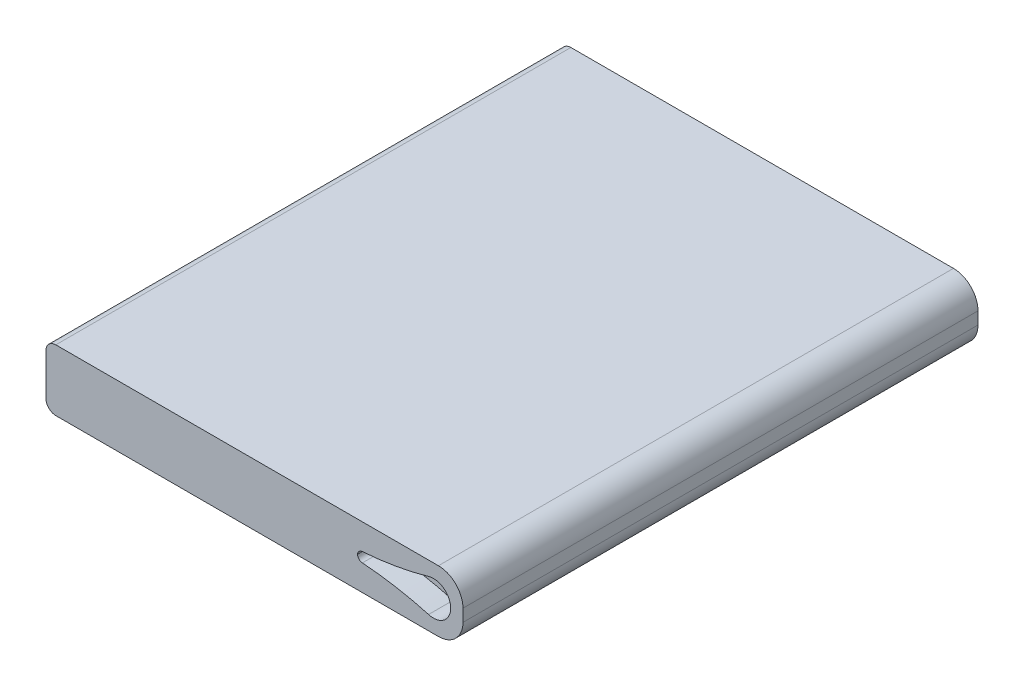
from build123d import *

# Parameters (mm, degrees)
SKETCH1_W           = 80
SKETCH1_H           = 105
SKETCH1_W_2         = 5
BOSS_EXTRUDE1_DEPTH = 12.5
CUT_EXTRUDE1_DEPTH  = 5
FILLET1_R           = 5
FILLET2_R           = 5
FILLET3_R           = 2


with BuildPart() as part:
    # Sketch1 → Boss-Extrude1 (new body)
    with BuildSketch(Plane(origin=(0, 0, 0), x_dir=(1, 0, 0), z_dir=(0, 1, 0))):
        with Locations((40, 52.5)):
            Rectangle(SKETCH1_W, SKETCH1_H)
        with Locations((-2.5, 52.5)):
            Rectangle(SKETCH1_W_2, SKETCH1_H)
    extrude(amount=BOSS_EXTRUDE1_DEPTH)

    # Sketch2 → Cut-Extrude1 (cut)
    with BuildSketch(Plane.XY):
        with BuildLine():
            ThreePointArc((73, 2.895898034), (76.091650066, 3.44375696), (77.5, 6.25))
            Line((77.5, 6.25), (74, 6.25))
            Line((74, 6.25), (73, 6.25))
            Line((73, 6.25), (73, 2.895898034))
        make_face()
        with BuildLine():
            Line((74, 6.25), (77.5, 6.25))
            ThreePointArc((77.5, 6.25), (76.091650066, 9.05624304), (73, 9.604101966))
            Line((73, 9.604101966), (73, 6.25))
            Line((73, 6.25), (74, 6.25))
        make_face()
        with BuildLine():
            Line((73, 6.25), (73, 9.604101966))
            ThreePointArc((73, 9.604101966), (71.19375696, 8.341650066), (70.5, 6.25))
            Line((70.5, 6.25), (73, 6.25))
        make_face()
        with BuildLine():
            ThreePointArc((70.5, 6.25), (71.19375696, 4.158349934), (73, 2.895898034))
            Line((73, 2.895898034), (73, 6.25))
            Line((73, 6.25), (70.5, 6.25))
        make_face()
        with BuildLine():
            ThreePointArc((59.5, 5.25), (66.307499895, 4.402691993), (73, 2.895898034))
            ThreePointArc((73, 2.895898034), (71.19375696, 4.158349934), (70.5, 6.25))
            Line((70.5, 6.25), (59.5, 6.25))
            Line((59.5, 6.25), (58.5, 6.25))
            ThreePointArc((58.5, 6.25), (58.814539324, 5.564539324), (59.5, 5.25))
        make_face()
        with BuildLine():
            ThreePointArc((70.5, 6.25), (71.19375696, 8.341650066), (73, 9.604101966))
            ThreePointArc((73, 9.604101966), (66.311170081, 8.076260701), (59.5, 7.25))
            ThreePointArc((59.5, 7.25), (58.812768212, 6.937231788), (58.5, 6.25))
            Line((58.5, 6.25), (59.5, 6.25))
            Line((59.5, 6.25), (70.5, 6.25))
        make_face()
    extrude(amount=-CUT_EXTRUDE1_DEPTH, mode=Mode.SUBTRACT)

    # Fillet1
    fillet1_edges = [part.edges().sort_by_distance(p)[0] for p in [
        (80, 0, -52.5),
    ]]
    fillet(fillet1_edges, radius=FILLET1_R)

    # Fillet2
    fillet2_edges = [part.edges().sort_by_distance(p)[0] for p in [
        (80, 12.5, -52.5),
    ]]
    fillet(fillet2_edges, radius=FILLET2_R)

    # Fillet3
    fillet3_edges = [part.edges().sort_by_distance(p)[0] for p in [
        (-5, 12.5, -52.5),
        (-5, 0, -52.5),
    ]]
    fillet(fillet3_edges, radius=FILLET3_R)


solid = part.part
